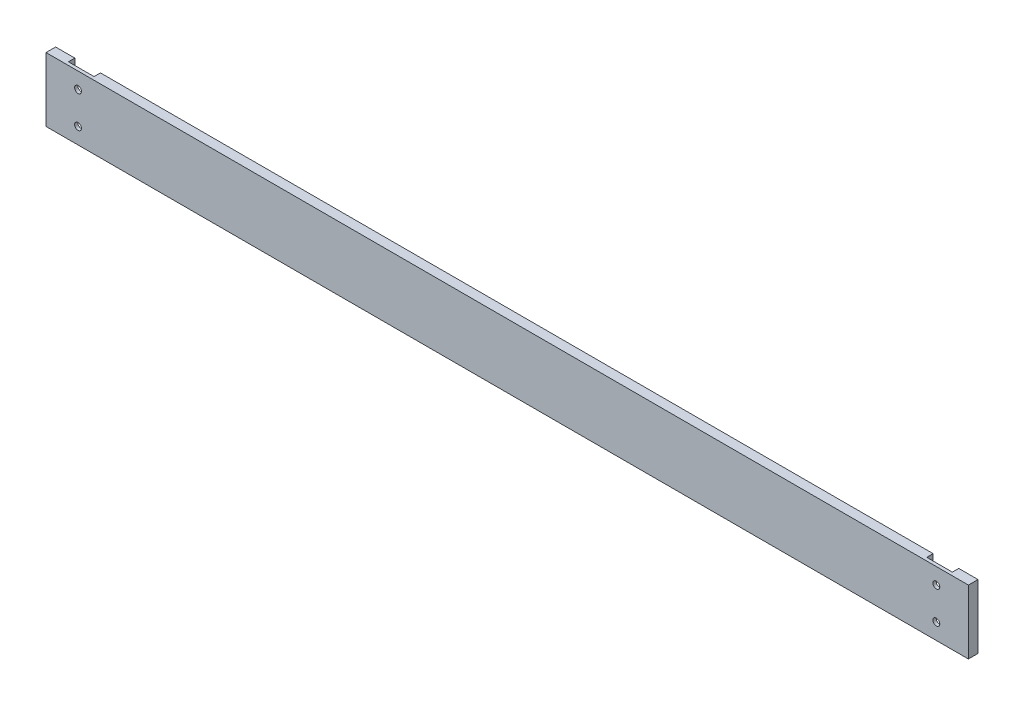
from build123d import *

# Parameters (mm, degrees)
SKETCH1_W               = 914.4
SKETCH1_H               = 9.525
BOSS_EXTRUDE1_DEPTH     = 63.5
SKETCH2_W               = 25.4
SKETCH2_H               = 63.5
CUT_EXTRUDE1_DEPTH      = 6.35
F_1_4_CLEARANCE_HOLE1_D = 6.7564
LPATTERN1_COUNT         = 3
LPATTERN1_PITCH         = 15.875
MIRROR1_COPY_1_D        = 6.7564


with BuildPart() as part:
    # Sketch1 → Boss-Extrude1 (new body)
    with BuildSketch(Plane(origin=(0, 0, 0), x_dir=(1, 0, 0), z_dir=(0, 1, 0))):
        with Locations((0, 4.7625)):
            Rectangle(SKETCH1_W, SKETCH1_H)
    extrude(amount=BOSS_EXTRUDE1_DEPTH)

    # Sketch2 → Cut-Extrude1 (cut)
    with BuildSketch(Plane(origin=(0, 0, -9.525), x_dir=(-1, 0, 0), z_dir=(0, 0, -1))):
        with Locations((-425.45, 31.75)):
            Rectangle(SKETCH2_W, SKETCH2_H)
    cut_extrude1 = extrude(amount=-CUT_EXTRUDE1_DEPTH, mode=Mode.SUBTRACT)

    # 1/4 Clearance Hole1 (through all)
    with Locations(Plane.XY):
        with Locations((425.45, 47.625)):
            f_1_4_clearance_hole1 = Hole(F_1_4_CLEARANCE_HOLE1_D / 2)

    # LPattern1: 1/4 Clearance Hole1 ×3, 1 skipped
    with Locations(*[(0, -i * LPATTERN1_PITCH, 0) for i in range(1, LPATTERN1_COUNT) if i not in (1,)]):
        add(f_1_4_clearance_hole1, mode=Mode.SUBTRACT)

    # Mirror1: Cut-Extrude1, 1/4 Clearance Hole1 across plane
    add(cut_extrude1.mirror(Plane(origin=(0, 0, 0), x_dir=(0, 0, 1), z_dir=(1, 0, 0))), mode=Mode.SUBTRACT)
    add(f_1_4_clearance_hole1.mirror(Plane(origin=(0, 0, 0), x_dir=(0, 0, 1), z_dir=(1, 0, 0))), mode=Mode.SUBTRACT)

    # Mirror1 copy 1 (through all)
    with Locations(Plane(origin=(0, -31.75, 0), x_dir=(-1, 0, 0), z_dir=(0, 0, 1))):
        with Locations((425.45, -47.625)):
            Hole(MIRROR1_COPY_1_D / 2)


solid = part.part
